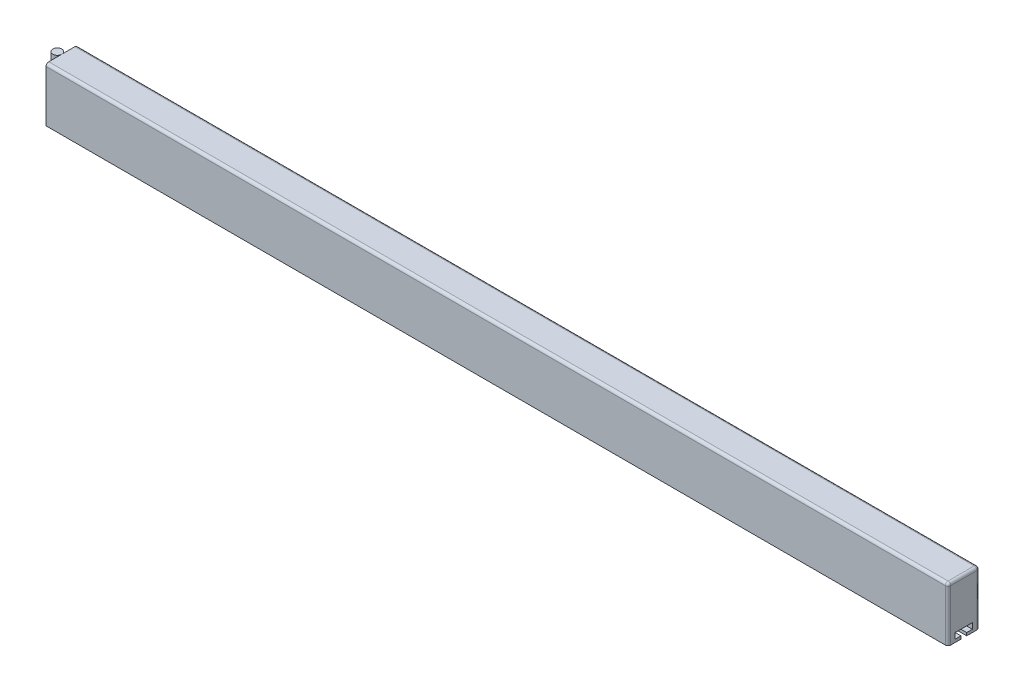
from build123d import *

# Parameters (mm, degrees)
CROQUIS1_W              = 2000
CROQUIS1_H              = 120
SALIENTE_EXTRUIR1_DEPTH = 70
CROQUIS2_R              = 10
SALIENTE_EXTRUIR2_DEPTH = 120
CORTAR_EXTRUIR1_DEPTH   = 2000
REDONDEO1_R             = 6
REDONDEO2_R             = 6


with BuildPart() as part:
    # Croquis1 → Saliente-Extruir1 (new body)
    with BuildSketch(Plane.XY):
        Rectangle(CROQUIS1_W, CROQUIS1_H)
    extrude(amount=SALIENTE_EXTRUIR1_DEPTH)

    # Croquis3 → Cortar-Extruir1 (cut)
    with BuildSketch(Plane(origin=(1000, 0, 0), x_dir=(0, 0, -1), z_dir=(1, 0, 0))):
        Polygon((-41.35, -60), (-41.35, -53.65), (-54.05, -53.65), (-54.05, -40.95), (-15.95, -40.95), (-15.95, -53.65), (-28.65, -53.65), (-28.65, -60), align=None)
    extrude(amount=-CORTAR_EXTRUIR1_DEPTH, mode=Mode.SUBTRACT)

    # Redondeo1
    redondeo1_edges = [part.edges().sort_by_distance(p)[0] for p in [
        (0, 60, 0),
        (0, 60, 70),
    ]]
    fillet(redondeo1_edges, radius=REDONDEO1_R)

    # Redondeo2
    redondeo2_edges = [part.edges().sort_by_distance(p)[0] for p in [
        (1000, -3, 70),
        (1000, 60, 35),
        (1000, 58.242640687, 68.242640687),
        (1000, 58.242640687, 1.757359313),
        (1000, -3, 0),
    ]]
    fillet(redondeo2_edges, radius=REDONDEO2_R)


with BuildPart() as body_2:
    # Croquis2 → Saliente-Extruir2 (new body)
    with BuildSketch(Plane(origin=(0, 60, 0), x_dir=(1, 0, 0), z_dir=(0, 1, 0))):
        with Locations(Location((-1010, -35, 0), (0, 0, 270))):
            Circle(CROQUIS2_R)
    extrude(amount=-SALIENTE_EXTRUIR2_DEPTH)


solid = Compound([part.part, body_2.part])
